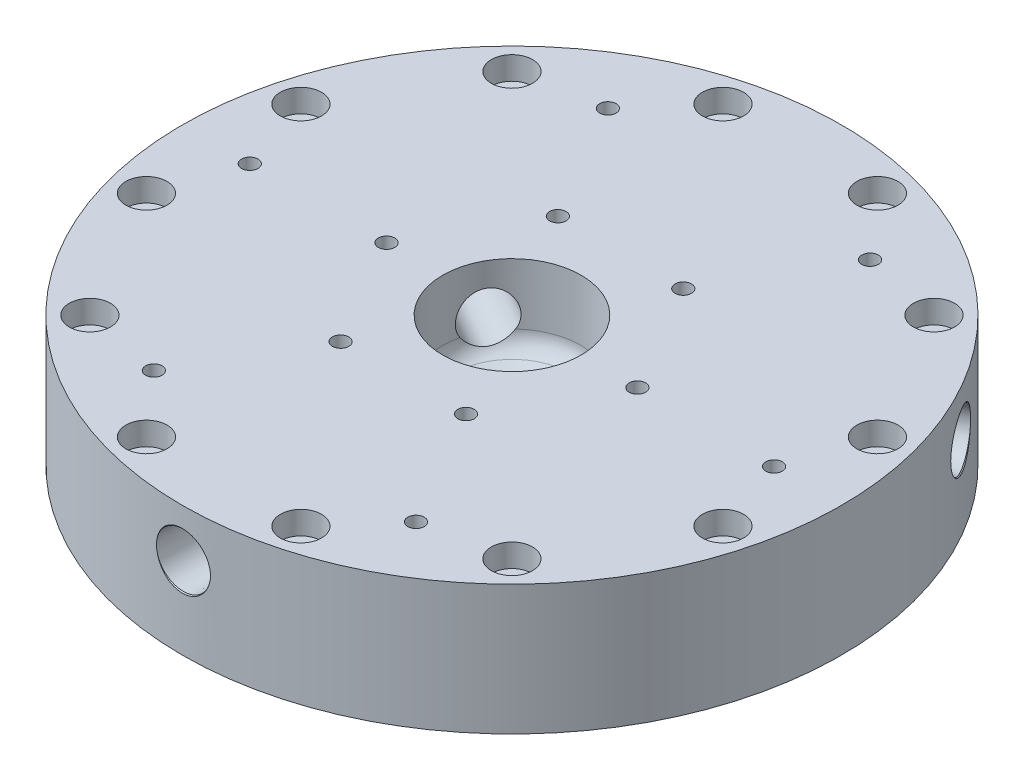
from build123d import *

# Parameters (mm, degrees)
SKETCH1_R                                       = 76.2
BOSS_EXTRUDE1_DEPTH                             = 30
CIRPATTERN1_COUNT                               = 3
CBORE_FOR_10_SOCKET_HEAD_CAP_SCREW1_D           = 4.9784
CBORE_FOR_10_SOCKET_HEAD_CAP_SCREW1_CBORE_D     = 9.525
CBORE_FOR_10_SOCKET_HEAD_CAP_SCREW1_CBORE_DEPTH = 5.325999
CIRPATTERN2_COUNT                               = 12
CIRPATTERN3_COUNT                               = 6
CIRPATTERN4_COUNT                               = 6
SKETCH29_R                                      = 55.14
SKETCH29_R_2                                    = 5.533
BOSS_EXTRUDE2_DEPTH                             = 2
FILLET1_R                                       = 0.127
CHAMFER1_SIZE                                   = 0.3


with BuildPart() as part:
    # Sketch1 → Boss-Extrude1 (new body)
    with BuildSketch(Plane(origin=(0, 0, 0), x_dir=(1, 0, 0), z_dir=(0, 1, 0))):
        with Locations(Location((0, 0, 0), (0, 0, 270))):
            Circle(SKETCH1_R)
    extrude(amount=BOSS_EXTRUDE1_DEPTH)

    # Sketch2 → Cut-Revolve1 (revolve, cut)
    with BuildSketch(Plane.XY):
        with BuildLine():
            Line((-5.533, 0), (-5.533, 4.113248654))
            ThreePointArc((-5.533, 4.113248654), (-6.202872981, 6.613248654), (-8.033, 8.443375673))
            Line((-8.033, 8.443375673), (-13.5, 11.599749595))
            ThreePointArc((-13.5, 11.599749595), (-15.330127019, 13.429876614), (-16, 15.929876614))
            Line((-16, 15.929876614), (-16, 30))
            Line((-16, 30), (0, 30))
            Line((0, 30), (0, 0))
            Line((0, 0), (-5.533, 0))
        make_face()
    revolve(axis=Axis((0, 30, 0), (0, -1, 0)), mode=Mode.SUBTRACT)

    # Sketch5 → 1/4 NPT Tapped Hole1 (revolve, cut)
    with BuildSketch(Plane(origin=(0, 18.904757199, 76.2), x_dir=(0, -1, 0), z_dir=(1, 0, 0))):
        Polygon((0, 0), (0, 68.542347279), (5.5626, 65.2), (5.5626, 10.02), (5.950661746, 10.02), (6.2436883, 0.2333117), (6.477, 0), align=None)
    f_1_4_npt_tapped_hole1 = revolve(axis=Axis((0, 18.904757199, 82.55), (0, 0, -1)), mode=Mode.SUBTRACT)

    # CirPattern1: 1/4 NPT Tapped Hole1 ×3 about axis
    cirpattern1_axis = Axis((0, 0, 0), (0, 1, 0))
    for i in range(1, CIRPATTERN1_COUNT):
        add(f_1_4_npt_tapped_hole1.rotate(cirpattern1_axis, i * 360 / CIRPATTERN1_COUNT), mode=Mode.SUBTRACT)

    # CBORE for #10 Socket Head Cap Screw1 (through all)
    with Locations(Plane(origin=(0, 30, 0), x_dir=(1, 0, 0), z_dir=(0, 1, 0))):
        with Locations((-17.858514112, -66.648882014)):
            cbore_for_10_socket_head_cap_screw1 = CounterBoreHole(CBORE_FOR_10_SOCKET_HEAD_CAP_SCREW1_D / 2, CBORE_FOR_10_SOCKET_HEAD_CAP_SCREW1_CBORE_D / 2, CBORE_FOR_10_SOCKET_HEAD_CAP_SCREW1_CBORE_DEPTH)

    # CirPattern2: CBORE for #10 Socket Head Cap Screw1 ×12 about axis
    cirpattern2_axis = Axis((0, 0, 0), (0, 1, 0))
    for i in range(1, CIRPATTERN2_COUNT):
        add(cbore_for_10_socket_head_cap_screw1.rotate(cirpattern2_axis, i * 360 / CIRPATTERN2_COUNT), mode=Mode.SUBTRACT)

    # Sketch19 → #10-24 Tapped Hole1 (revolve, cut)
    with BuildSketch(Plane(origin=(30.305, 30, -52.489799723), x_dir=(0, 0, 1), z_dir=(1, 0, 0))):
        Polygon((0, 0), (0, 13.970824014), (1.89865, 12.83), (1.89865, 0), align=None)
    f_10_24_tapped_hole1 = revolve(axis=Axis((30.305, 36.35, -52.489799723), (0, -1, 0)), mode=Mode.SUBTRACT)

    # CirPattern3: #10-24 Tapped Hole1 ×6 about axis
    cirpattern3_axis = Axis((0, 0, 0), (0, 1, 0))
    for i in range(1, CIRPATTERN3_COUNT):
        add(f_10_24_tapped_hole1.rotate(cirpattern3_axis, i * 360 / CIRPATTERN3_COUNT), mode=Mode.SUBTRACT)

    # Sketch21 → Cut-Revolve2 (revolve, cut)
    with BuildSketch(Plane.XY, mode=Mode.PRIVATE) as cut_revolve2_sk:
        with BuildLine():
            Line((58.5343, 0), (62.5983, 0))
            Line((62.5983, 0), (62.5983, 2.1844))
            ThreePointArc((62.5983, 2.1844), (62.449510245, 2.543610245), (62.0903, 2.6924))
            Line((62.0903, 2.6924), (59.0423, 2.6924))
            ThreePointArc((59.0423, 2.6924), (58.683089755, 2.543610245), (58.5343, 2.1844))
            Line((58.5343, 2.1844), (58.5343, 0))
        make_face()
    revolve(cut_revolve2_sk.sketch.rotate(Axis((0, 0, 0), (0, -1, 0)), 90), axis=Axis((0, 0, 0), (0, -1, 0)), mode=Mode.SUBTRACT)

    # Sketch28 → #21 (0.159) Diameter Hole1 (revolve, cut)
    with BuildSketch(Plane(origin=(29, 30, 0), x_dir=(0, 0, 1), z_dir=(1, 0, 0))):
        Polygon((0, 0), (0, 19.140824014), (1.89865, 18), (1.89865, 0), align=None)
    f_21_0_159_diameter_hole1 = revolve(axis=Axis((29, 36.35, 0), (0, -1, 0)), mode=Mode.SUBTRACT)

    # CirPattern4: #21 (0.159) Diameter Hole1 ×6 about axis
    cirpattern4_axis = Axis((0, 0, 0), (0, 1, 0))
    for i in range(1, CIRPATTERN4_COUNT):
        add(f_21_0_159_diameter_hole1.rotate(cirpattern4_axis, i * 360 / CIRPATTERN4_COUNT), mode=Mode.SUBTRACT)

    # Sketch29 → Boss-Extrude2 (add)
    with BuildSketch(Plane(origin=(0, 0, 0), x_dir=(-1, 0, 0), z_dir=(0, -1, 0))):
        with Locations(Location((0, 0, 0), (0, 0, 90))):
            Circle(SKETCH29_R)
        Circle(SKETCH29_R_2, mode=Mode.SUBTRACT)
    extrude(amount=BOSS_EXTRUDE2_DEPTH)

    # Fillet1
    fillet1_edges = [part.edges().sort_by_distance(p)[0] for p in [
        (0, 0, -62.5983),
        (0, 0, -58.5343),
    ]]
    fillet(fillet1_edges, radius=FILLET1_R)

    # Chamfer1
    chamfer1_edges = [part.edges().sort_by_distance(p)[0] for p in [
        (0, -2, 55.14),
    ]]
    chamfer(chamfer1_edges, length=CHAMFER1_SIZE)


solid = part.part
